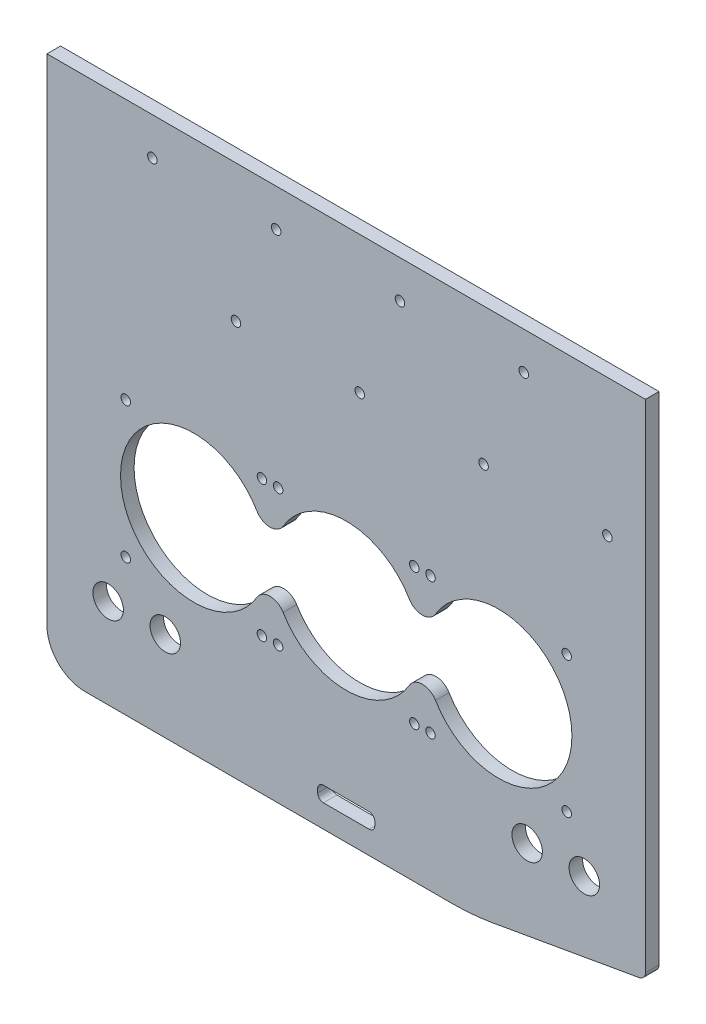
from build123d import *

# Parameters (mm, degrees)
SKETCH1_W           = 314.224
SKETCH1_H           = 280
BOSS_EXTRUDE1_DEPTH = 7.112
SKETCH2_R           = 2.5
CUT_EXTRUDE1_DEPTH  = 304.866353991
SKETCH3_R           = 2.5
CUT_EXTRUDE2_DEPTH  = 6.731
SKETCH6_R           = 8
CUT_EXTRUDE5_DEPTH  = 304.866353991
LPATTERN1_COUNT     = 4
LPATTERN1_PITCH     = 65
CUT_EXTRUDE3_DEPTH  = 304.866353991
CUT_EXTRUDE4_DEPTH  = 304.866353991
FILLET1_R           = 120
FILLET2_R           = 20
FILLET3_R           = 4


with BuildPart() as part:
    # Sketch1 → Boss-Extrude1 (new body)
    with BuildSketch(Plane(origin=(0, 0, 0), x_dir=(1, 0, 0), z_dir=(0, 0, -1))):
        with Locations((0, -120)):
            Rectangle(SKETCH1_W, SKETCH1_H)
    extrude(amount=BOSS_EXTRUDE1_DEPTH)

    # Sketch2 → Cut-Extrude1 (cut, through all)
    with BuildSketch(Plane.XY):
        with Locations((-115.75, 123.362)):
            Circle(SKETCH2_R)
        with Locations((-44.25, 123.362)):
            Circle(SKETCH2_R)
        with Locations((-35.75, 123.362)):
            Circle(SKETCH2_R)
        with Locations(Location((-115.75, 51.862, 0), (0, 0, 180))):
            Circle(SKETCH2_R)
        with Locations(Location((-44.25, 51.862, 0), (0, 0, 180))):
            Circle(SKETCH2_R)
        with Locations(Location((-35.75, 51.862, 0), (0, 0, 180))):
            Circle(SKETCH2_R)
        with Locations((115.75, 51.862)):
            Circle(SKETCH2_R)
        with Locations((44.25, 51.862)):
            Circle(SKETCH2_R)
        with Locations((35.75, 51.862)):
            Circle(SKETCH2_R)
        with Locations(Location((35.75, 123.362, 0), (0, 0, 180))):
            Circle(SKETCH2_R)
        with Locations(Location((44.25, 123.362, 0), (0, 0, 180))):
            Circle(SKETCH2_R)
        with Locations(Location((115.75, 123.362, 0), (0, 0, 180))):
            Circle(SKETCH2_R)
        with BuildLine():
            ThreePointArc((33.11827957, 107.244359979), (0, 126.112), (-33.11827957, 107.244359979))
            ThreePointArc((-33.11827957, 107.244359979), (-40, 103.323811403), (-46.88172043, 107.244359979))
            ThreePointArc((-46.88172043, 107.244359979), (-118.5, 87.612), (-46.88172043, 67.979640021))
            ThreePointArc((-46.88172043, 67.979640021), (-40, 71.900188597), (-33.11827957, 67.979640021))
            ThreePointArc((-33.11827957, 67.979640021), (0, 49.112), (33.11827957, 67.979640021))
            ThreePointArc((33.11827957, 67.979640021), (40, 71.900188597), (46.88172043, 67.979640021))
            ThreePointArc((46.88172043, 67.979640021), (118.5, 87.612), (46.88172043, 107.244359979))
            ThreePointArc((46.88172043, 107.244359979), (40, 103.323811403), (33.11827957, 107.244359979))
        make_face()
    extrude(amount=-CUT_EXTRUDE1_DEPTH, mode=Mode.SUBTRACT)

    # Sketch3 → Cut-Extrude2 (cut)
    with BuildSketch(Plane.XY):
        with Locations((137.112, 188)):
            Circle(SKETCH3_R)
        with Locations((93.225547391, 240.301837563)):
            Circle(SKETCH3_R)
    cut_extrude2 = extrude(amount=-CUT_EXTRUDE2_DEPTH, mode=Mode.SUBTRACT)

    # Sketch6 → Cut-Extrude5 (cut, through all)
    with BuildSketch(Plane(origin=(0, 0, -7.112), x_dir=(-1, 0, 0), z_dir=(0, 0, -1))):
        with Locations((-125, 27.112)):
            Circle(SKETCH6_R)
        with Locations((-95, 27.112)):
            Circle(SKETCH6_R)
        with Locations(Location((95, 27.112, 0), (0, 0, 180))):
            Circle(SKETCH6_R)
        with Locations(Location((125, 27.112, 0), (0, 0, 180))):
            Circle(SKETCH6_R)
    extrude(amount=-CUT_EXTRUDE5_DEPTH, mode=Mode.SUBTRACT)

    # LPattern1: Cut-Extrude2 ×4
    with Locations(*[(-i * LPATTERN1_PITCH, 0, 0) for i in range(1, LPATTERN1_COUNT)]):
        add(cut_extrude2, mode=Mode.SUBTRACT)

    # Sketch4 → Cut-Extrude3 (cut, through all)
    with BuildSketch(Plane.XY):
        with BuildLine():
            Line((-12, -8), (12, -8))
            ThreePointArc((12, -8), (14.121320344, -7.121320344), (15, -5))
            Line((15, -5), (15, -3))
            ThreePointArc((15, -3), (14.121320344, -0.878679656), (12, 0))
            Line((12, 0), (-12, 0))
            ThreePointArc((-12, 0), (-14.121320344, -0.878679656), (-15, -3))
            Line((-15, -3), (-15, -5))
            ThreePointArc((-15, -5), (-14.121320344, -7.121320344), (-12, -8))
        make_face()
    extrude(amount=-CUT_EXTRUDE3_DEPTH, mode=Mode.SUBTRACT)

    # Sketch5 → Cut-Extrude4 (cut, through all)
    with BuildSketch(Plane.XY):
        Polygon((66.371490886, -20), (157.112, -4), (157.112, -20), align=None)
    extrude(amount=-CUT_EXTRUDE4_DEPTH, mode=Mode.SUBTRACT)

    # Fillet1
    fillet1_edges = [part.edges().sort_by_distance(p)[0] for p in [
        (66.371490886, -20, -3.556),
    ]]
    fillet(fillet1_edges, radius=FILLET1_R)

    # Fillet2
    fillet2_edges = [part.edges().sort_by_distance(p)[0] for p in [
        (-157.112, -20, -3.556),
    ]]
    fillet(fillet2_edges, radius=FILLET2_R)

    # Fillet3
    fillet3_edges = [part.edges().sort_by_distance(p)[0] for p in [
        (157.112, -4, -3.556),
    ]]
    fillet(fillet3_edges, radius=FILLET3_R)


solid = part.part
